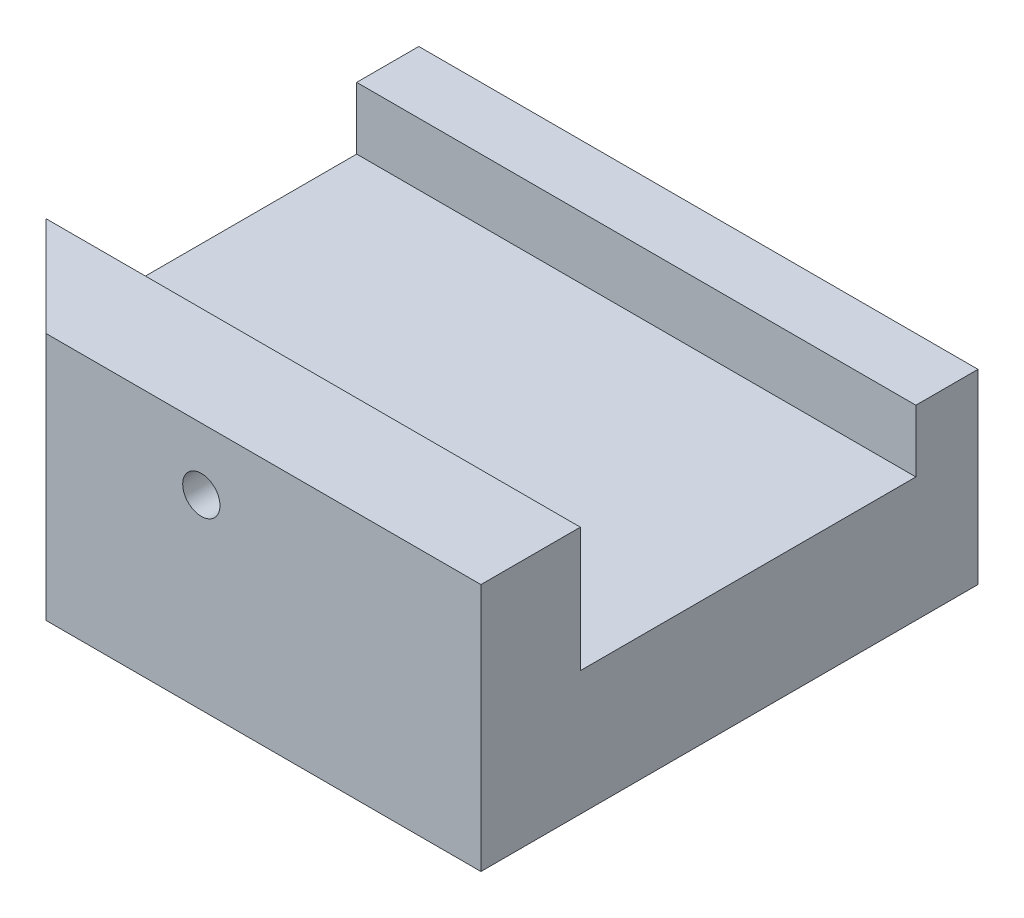
from build123d import *

# Parameters (mm, degrees)
SKETCH_1_W          = 45
SKETCH_1_H          = 40
EXTRUDE_1_DEPTH     = 20
SKETCH_2_W          = 45
SKETCH_2_H          = 10
CUT_EXTRUDE_1_DEPTH = 32
SKETCH_3_W          = 45
SKETCH_3_H          = 5
EXTRUDE_2_DEPTH     = 5
SKETCH_4_R          = 1.5
CUT_EXTRUDE_2_DEPTH = 44.934610502
CHAMFER_1_SIZE      = 10


with BuildPart() as part:
    # 草图1 → 凸台-拉伸1 (new body)
    with BuildSketch(Plane(origin=(0, 0, 0), x_dir=(1, 0, 0), z_dir=(0, 1, 0))):
        Rectangle(SKETCH_1_W, SKETCH_1_H)
    extrude(amount=EXTRUDE_1_DEPTH)

    # 草图2 → 切除-拉伸1 (cut)
    with BuildSketch(Plane(origin=(0, 0, -20), x_dir=(-1, 0, 0), z_dir=(0, 0, -1))):
        with Locations((0, 15)):
            Rectangle(SKETCH_2_W, SKETCH_2_H)
    extrude(amount=-CUT_EXTRUDE_1_DEPTH, mode=Mode.SUBTRACT)

    # 草图3 → 凸台-拉伸2 (add)
    with BuildSketch(Plane(origin=(0, 10, 0), x_dir=(1, 0, 0), z_dir=(0, 1, 0))):
        with Locations((0, 17.5)):
            Rectangle(SKETCH_3_W, SKETCH_3_H)
    extrude(amount=EXTRUDE_2_DEPTH)

    # 草图4 → 切除-拉伸2 (cut, through all)
    with BuildSketch(Plane(origin=(0, 0, 12), x_dir=(-1, 0, 0), z_dir=(0, 0, -1))):
        with Locations((0, 15)):
            Circle(SKETCH_4_R)
    extrude(amount=-CUT_EXTRUDE_2_DEPTH, mode=Mode.SUBTRACT)

    # 倒角1
    chamfer_1_edges = [part.edges().sort_by_distance(p)[0] for p in [
        (-22.5, 10, 20),
    ]]
    chamfer(chamfer_1_edges, length=CHAMFER_1_SIZE)


solid = part.part
